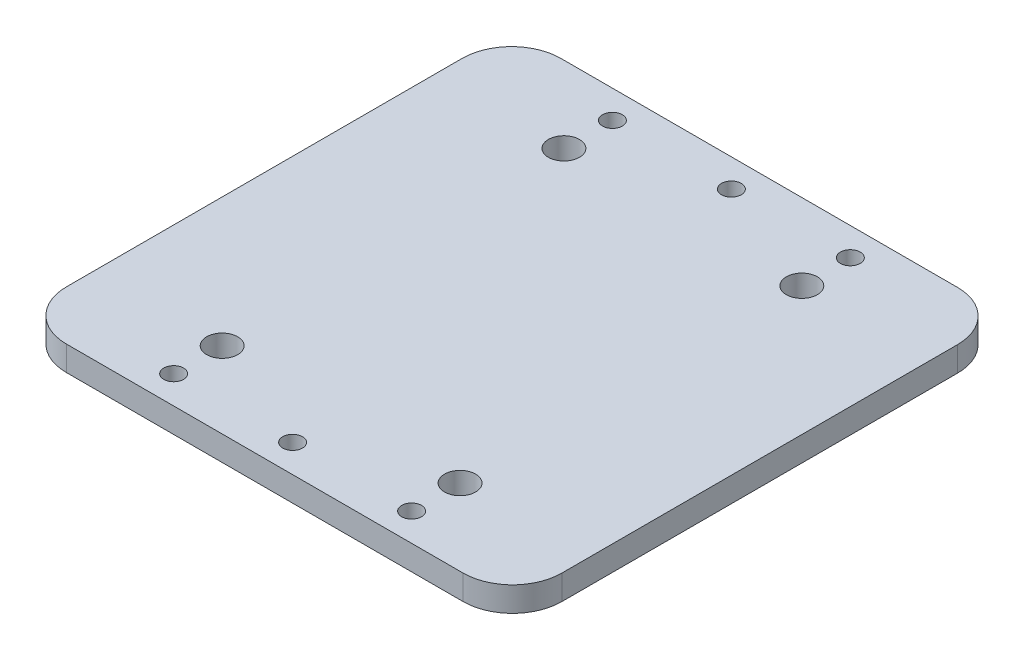
from build123d import *

# Parameters (mm, degrees)
SKETCH_1_W      = 100.2
SKETCH_1_H      = 100
SKETCH_1_R      = 3.14
SKETCH_1_R_2    = 2
EXTRUDE_1_DEPTH = 5
FILLET_1_R      = 10


with BuildPart() as part:
    # 草图1 → 凸台-拉伸1 (new body)
    with BuildSketch(Plane(origin=(0, 0, 0), x_dir=(1, 0, 0), z_dir=(0, 1, 0))):
        with Locations((4.40209205, 20.757531381)):
            Rectangle(SKETCH_1_W, SKETCH_1_H)
        with Locations(Location((-19.64790795, 55.307531381, 0), (0, 0, 270))):
            Circle(SKETCH_1_R, mode=Mode.SUBTRACT)
        with Locations(Location((28.45209205, 55.307531381, 0), (0, 0, 270))):
            Circle(SKETCH_1_R, mode=Mode.SUBTRACT)
        with Locations(Location((28.45209205, -13.792468619, 0), (0, 0, 270))):
            Circle(SKETCH_1_R, mode=Mode.SUBTRACT)
        with Locations(Location((-19.64790795, -13.792468619, 0), (0, 0, 270))):
            Circle(SKETCH_1_R, mode=Mode.SUBTRACT)
        with Locations(Location((-19.64790795, 65.110023284, 0), (0, 0, 270))):
            Circle(SKETCH_1_R_2, mode=Mode.SUBTRACT)
        with Locations(Location((4.40209205, 65.110023284, 0), (0, 0, 270))):
            Circle(SKETCH_1_R_2, mode=Mode.SUBTRACT)
        with Locations(Location((28.45209205, 65.110023284, 0), (0, 0, 270))):
            Circle(SKETCH_1_R_2, mode=Mode.SUBTRACT)
        with Locations(Location((28.45209205, -23.594960523, 0), (0, 0, 90))):
            Circle(SKETCH_1_R_2, mode=Mode.SUBTRACT)
        with Locations(Location((4.40209205, -23.594960523, 0), (0, 0, 90))):
            Circle(SKETCH_1_R_2, mode=Mode.SUBTRACT)
        with Locations(Location((-19.64790795, -23.594960523, 0), (0, 0, 90))):
            Circle(SKETCH_1_R_2, mode=Mode.SUBTRACT)
    extrude(amount=EXTRUDE_1_DEPTH)

    # 圆角1
    fillet_1_edges = [part.edges().sort_by_distance(p)[0] for p in [
        (-45.69790795, 2.5, -70.757531381),
        (54.50209205, 2.5, -70.757531381),
        (54.50209205, 2.5, 29.242468619),
        (-45.69790795, 2.5, 29.242468619),
    ]]
    fillet(fillet_1_edges, radius=FILLET_1_R)


solid = part.part
